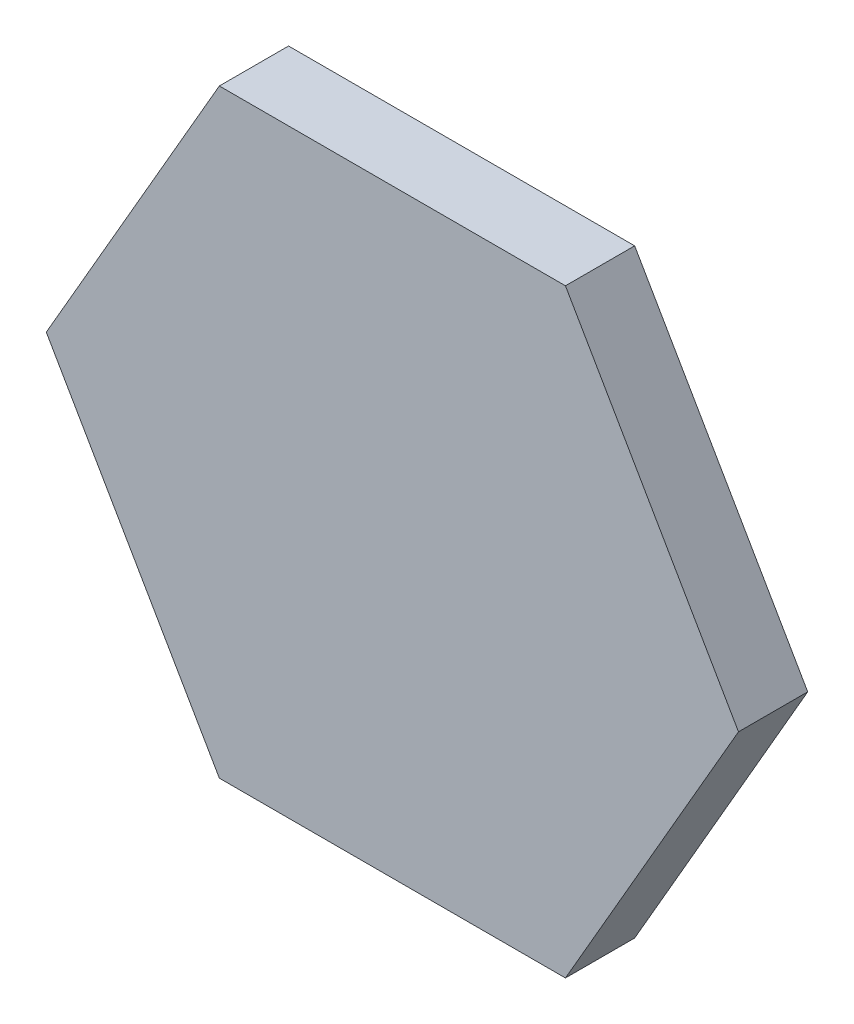
from build123d import *

# Parameters (mm, degrees)
BOSS_EXTRU_1_DEPTH = 15


with BuildPart() as part:
    # Esquisse1 → Boss.-Extru.1 (new body)
    with BuildSketch(Plane.XY):
        Polygon((37.5, -64.951905284), (75, 0), (37.5, 64.951905284), (-37.5, 64.951905284), (-75, 0), (-37.5, -64.951905284), align=None)
    extrude(amount=BOSS_EXTRU_1_DEPTH)


solid = part.part
